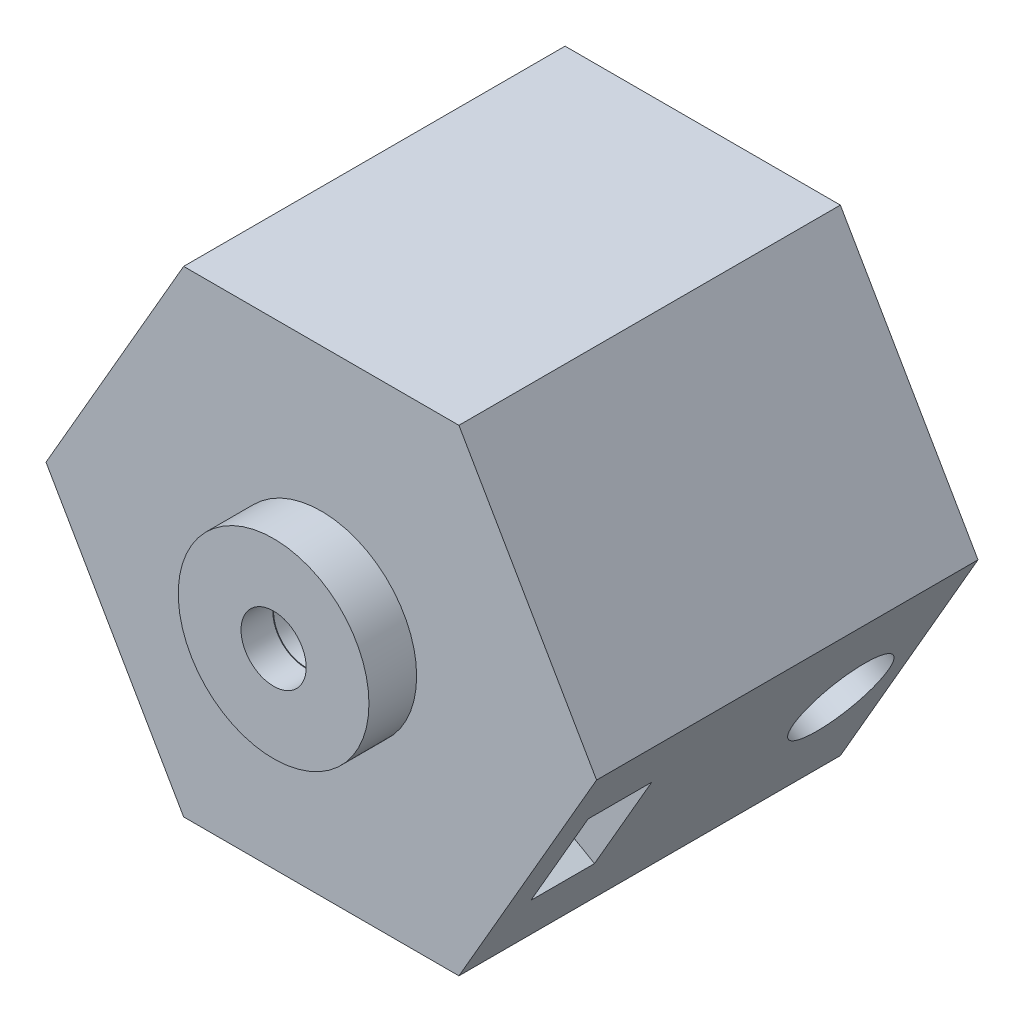
from build123d import *

# Parameters (mm, degrees)
SALIENTE_EXTRUIR1_DEPTH = 11
CROQUIS2_R              = 2
SALIENTE_EXTRUIR3_DEPTH = 16
CROQUIS3_R              = 2.05
CORTAR_EXTRUIR1_DEPTH   = 2
CROQUIS4_R              = 3.5
CORTAR_EXTRUIR2_DEPTH   = 4
CROQUIS5_W              = 4
CROQUIS5_H              = 7.2
CORTAR_EXTRUIR3_DEPTH   = 47.411205543
CROQUIS6_R              = 3
CORTAR_EXTRUIR4_DEPTH   = 47.411205543
CROQUIS7_R              = 6
CORTAR_EXTRUIR5_DEPTH   = 3


with BuildPart() as part:
    # Croquis1 → Saliente-Extruir1 (new body)
    with BuildSketch(Plane.XY):
        Polygon((17.320508076, 0), (8.660254038, 15), (-8.660254038, 15), (-17.320508076, 0), (-8.660254038, -15), (8.660254038, -15), align=None)
        Polygon((12.701705922, 0), (6.350852961, 11), (-6.350852961, 11), (-12.701705922, 0), (-6.350852961, -11), (6.350852961, -11), align=None, mode=Mode.SUBTRACT)
    extrude(amount=SALIENTE_EXTRUIR1_DEPTH)

    # Croquis2 → Saliente-Extruir3 (add)
    with BuildSketch(Plane.XY.offset(11)):
        Polygon((-8.660254038, 15), (-17.320508076, 0), (-8.660254038, -15), (8.660254038, -15), (17.320508076, 0), (8.660254038, 15), align=None)
        Circle(CROQUIS2_R, mode=Mode.SUBTRACT)
    extrude(amount=SALIENTE_EXTRUIR3_DEPTH)

    # Croquis3 → Cortar-Extruir1 (cut)
    with BuildSketch(Plane.XY.offset(27)):
        Circle(CROQUIS3_R)
    extrude(amount=-CORTAR_EXTRUIR1_DEPTH, mode=Mode.SUBTRACT)

    # Croquis4 → Cortar-Extruir2 (cut)
    with BuildSketch(Plane(origin=(0, 0, 11), x_dir=(-1, 0, 0), z_dir=(0, 0, -1))):
        Circle(CROQUIS4_R)
    extrude(amount=-CORTAR_EXTRUIR2_DEPTH, mode=Mode.SUBTRACT)

    # Croquis5 → Cortar-Extruir3 (cut, through all)
    with BuildSketch(Plane(origin=(-12.990381057, 7.5, 0), x_dir=(0, 0, 1), z_dir=(-0.8660254037844386, 0.5, 0))):
        with Locations((20, 0)):
            Rectangle(CROQUIS5_W, CROQUIS5_H)
    extrude(amount=-CORTAR_EXTRUIR3_DEPTH, mode=Mode.SUBTRACT)

    # Croquis6 → Cortar-Extruir4 (cut, through all)
    with BuildSketch(Plane(origin=(-12.990381057, 7.5, 0), x_dir=(0, 0, 1), z_dir=(-0.8660254037844386, 0.5, 0))):
        with Locations(Location((4.3, 0, 0), (0, 0, 270))):
            Circle(CROQUIS6_R)
    extrude(amount=-CORTAR_EXTRUIR4_DEPTH, mode=Mode.SUBTRACT)

    # Croquis7 → Cortar-Extruir5 (cut)
    with BuildSketch(Plane.XY.offset(27)):
        Polygon((-8.660254038, 15), (-17.320508076, 0), (-8.660254038, -15), (8.660254038, -15), (17.320508076, 0), (8.660254038, 15), align=None)
        Circle(CROQUIS7_R, mode=Mode.SUBTRACT)
    extrude(amount=-CORTAR_EXTRUIR5_DEPTH, mode=Mode.SUBTRACT)


solid = part.part
